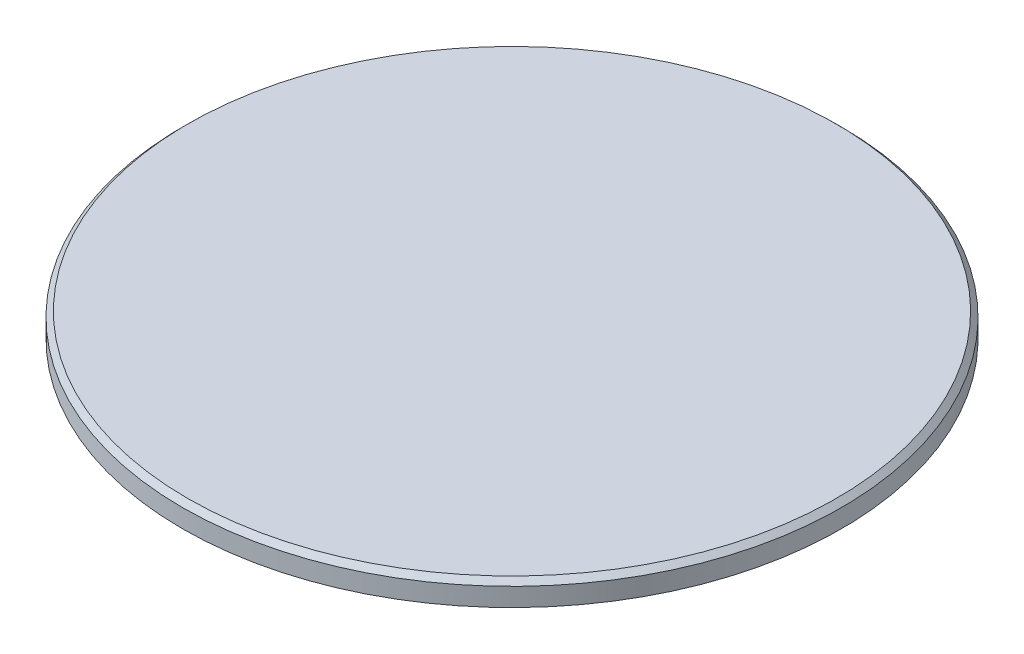
from build123d import *

# Parameters (mm, degrees)
SKETCH1_R           = 12.55
BOSS_EXTRUDE1_DEPTH = 0.9
CHAMFER1_SIZE       = 0.2


with BuildPart() as part:
    # Sketch1 → Boss-Extrude1 (new body)
    with BuildSketch(Plane(origin=(0, 0, 0), x_dir=(1, 0, 0), z_dir=(0, 1, 0))):
        with Locations(Location((0, 0, 0), (0, 0, 270))):
            Circle(SKETCH1_R)
    extrude(amount=BOSS_EXTRUDE1_DEPTH)

    # Chamfer1
    chamfer1_edges = [part.edges().sort_by_distance(p)[0] for p in [
        (0, 0.9, -12.55),
    ]]
    chamfer(chamfer1_edges, length=CHAMFER1_SIZE)


solid = part.part
